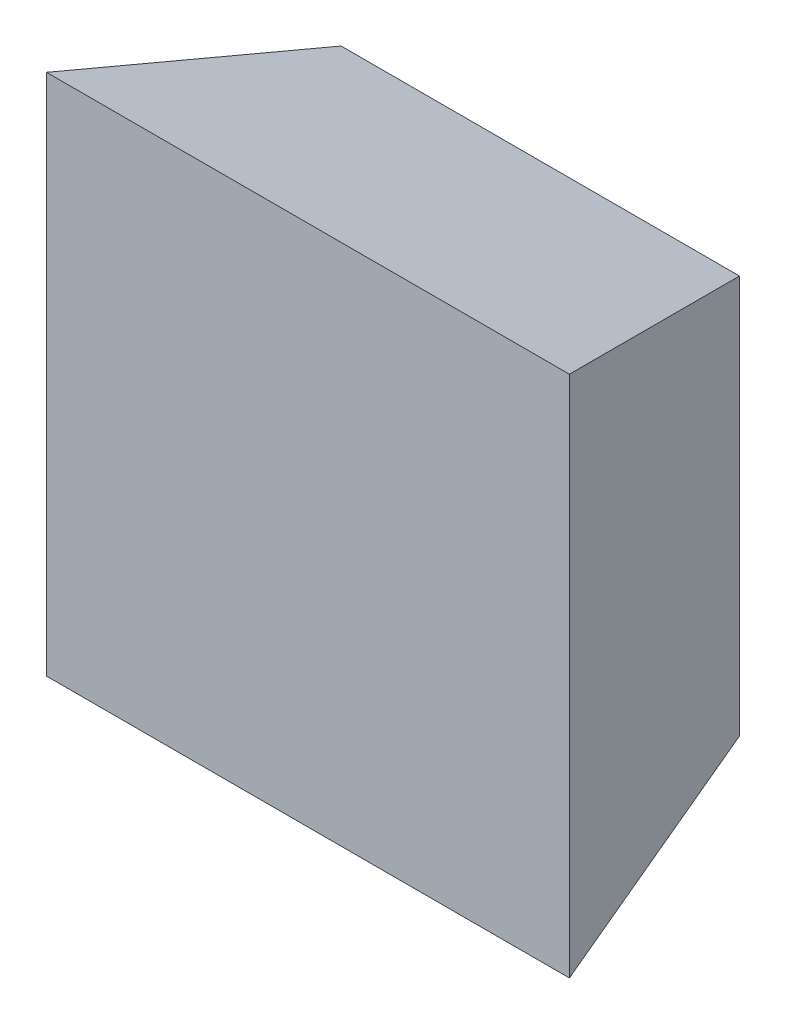
from build123d import *

# Parameters (mm, degrees)
ESQUISSE1_W             = 25.4
ESQUISSE1_H             = 25.4
BOSS_EXTRU_1_DEPTH      = 14.81582
BOSS_EXTRU_1_DRAFT      = -15
ENL_V_MAT_EXTRU_1_DEPTH = 12.7


with BuildPart() as part:
    # Esquisse1 → Boss.-Extru.1 (with draft: the straight prism first)
    with BuildSketch(Plane.XY):
        Rectangle(ESQUISSE1_W, ESQUISSE1_H)
    extrude(amount=BOSS_EXTRU_1_DEPTH)
    # Boss.-Extru.1: the draft: its side faces are tilted about the plane it starts from
    boss_extru_1_sides = [part.faces().sort_by_distance(p)[0] for p in [
        (0, -12.7, 7.40791),
        (12.7, 0, 7.40791),
        (0, 12.7, 7.40791),
        (-12.7, 0, 7.40791),
    ]]
    draft(boss_extru_1_sides, Plane.XY, BOSS_EXTRU_1_DRAFT)

    # Esquisse5 → Enlèv. mat.-Extru.1 (cut)
    with BuildSketch(Plane(origin=(0, -17.78, 0), x_dir=(1, 0, 0), z_dir=(0, 1, 0))):
        with BuildLine():
            ThreePointArc((0, -5.741035), (-1.178658616, -8.586568616), (1.666875, -7.40791))
            ThreePointArc((1.666875, -7.40791), (1.178658616, -6.229251384), (0, -5.741035))
        make_face()
    extrude(amount=ENL_V_MAT_EXTRU_1_DEPTH, mode=Mode.SUBTRACT)


solid = part.part
